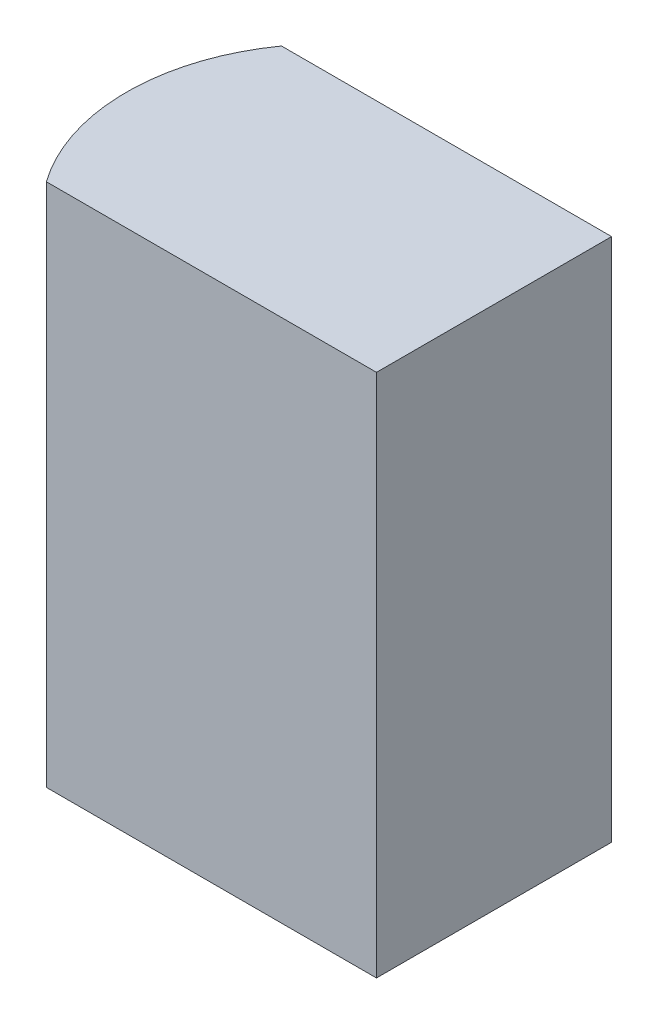
from build123d import *

# Parameters (mm, degrees)
BOSS_EXTRUDE1_DEPTH = 580


with BuildPart() as part:
    # Sketch1 → Boss-Extrude1 (new body)
    with BuildSketch(Plane(origin=(0, 0, 0), x_dir=(1, 0, 0), z_dir=(0, 1, 0))):
        with BuildLine():
            Line((-182.5, -130), (182.5, -130))
            Line((182.5, -130), (182.5, 130))
            Line((182.5, 130), (-182.5, 130))
            ThreePointArc((-182.5, 130), (-224.067512148, 0), (-182.5, -130))
        make_face()
    extrude(amount=BOSS_EXTRUDE1_DEPTH)


solid = part.part
